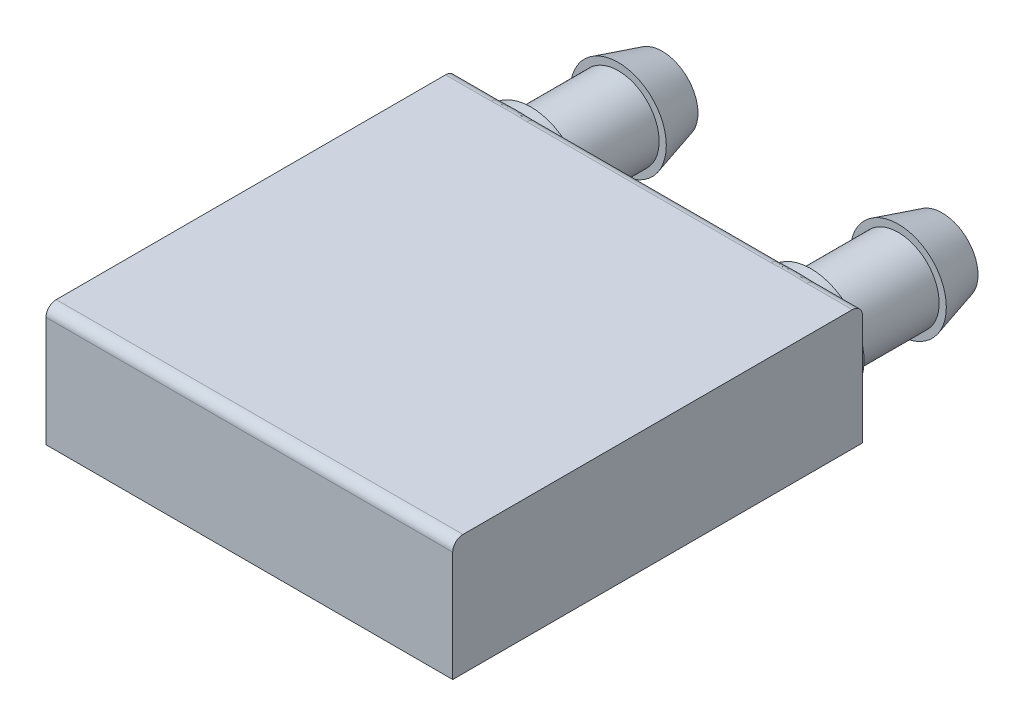
from build123d import *

# Parameters (mm, degrees)
SKETCH1_W           = 39.8
SKETCH1_H           = 40.1
BOSS_EXTRUDE1_DEPTH = 11.8
SKETCH2_R           = 5.2
BOSS_EXTRUDE2_DEPTH = 1.15
SKETCH3_R           = 4
BOSS_EXTRUDE3_DEPTH = 8.55
SKETCH4_W           = 1.985131543
SKETCH4_H           = 1.538416695
BOSS_EXTRUDE4_DEPTH = 1
SKETCH10_W          = 1.450314217
SKETCH10_H          = 0.967398797
BOSS_EXTRUDE5_DEPTH = 1
SKETCH12_R          = 3.15
CUT_EXTRUDE1_DEPTH  = 15
FILLET1_R           = 1


with BuildPart() as part:
    # Sketch1 → Boss-Extrude1 (new body)
    with BuildSketch(Plane(origin=(0, 0, 0), x_dir=(1, 0, 0), z_dir=(0, 1, 0))):
        with Locations((19.9, 20.05)):
            Rectangle(SKETCH1_W, SKETCH1_H)
    extrude(amount=BOSS_EXTRUDE1_DEPTH)

    # Sketch2 → Boss-Extrude2 (add)
    with BuildSketch(Plane(origin=(0, 0, -40.1), x_dir=(-1, 0, 0), z_dir=(0, 0, -1))):
        with Locations(Location((-6.2, 5.9, 0), (0, 0, 180))):
            Circle(SKETCH2_R)
        with Locations(Location((-33.6, 5.9, 0), (0, 0, 180))):
            Circle(SKETCH2_R)
    extrude(amount=BOSS_EXTRUDE2_DEPTH)

    # Sketch3 → Boss-Extrude3 (add)
    with BuildSketch(Plane(origin=(0, 0, -41.25), x_dir=(-1, 0, 0), z_dir=(0, 0, -1))):
        with Locations((-33.6, 5.9)):
            Circle(SKETCH3_R)
        with Locations((-6.2, 5.9)):
            Circle(SKETCH3_R)
    extrude(amount=BOSS_EXTRUDE3_DEPTH)

    # Sketch4 → Boss-Extrude4 (add)
    with BuildSketch(Plane(origin=(0, 0, -49.8), x_dir=(-1, 0, 0), z_dir=(0, 0, -1))):
        with Locations((-7.192565771, 5.130791653)):
            Rectangle(SKETCH4_W, SKETCH4_H)
    extrude(amount=BOSS_EXTRUDE4_DEPTH)

    # Sketch7 → Revolve2 (revolve)
    with BuildSketch(Plane(origin=(0, 5.9, 0), x_dir=(1, 0, 0), z_dir=(0, 1, 0))):
        Polygon((6.2, 49.8), (10.9, 49.8), (9.7, 54.1), (6.2, 54.1), align=None)
    revolve(axis=Axis((6.2, 5.9, -49.8), (0, 0, -1)))

    # Sketch10 → Boss-Extrude5 (add)
    with BuildSketch(Plane(origin=(0, 0, -49.8), x_dir=(-1, 0, 0), z_dir=(0, 0, -1))):
        with Locations((-34.325157109, 5.416300601)):
            Rectangle(SKETCH10_W, SKETCH10_H)
    extrude(amount=BOSS_EXTRUDE5_DEPTH)

    # Sketch11 → Revolve4 (revolve)
    with BuildSketch(Plane(origin=(0, 5.9, 0), x_dir=(1, 0, 0), z_dir=(0, 1, 0)), mode=Mode.PRIVATE) as revolve4_sk:
        Polygon((33.6, 49.8), (28.9, 49.8), (30.1, 54.1), (33.6, 54.1), align=None)
    revolve(revolve4_sk.sketch.rotate(Axis((33.6, 5.9, -49.8), (0, 0, -1)), 180), axis=Axis((33.6, 5.9, -49.8), (0, 0, -1)))

    # Sketch12 → Cut-Extrude1 (cut)
    with BuildSketch(Plane(origin=(0, 0, -54.1), x_dir=(-1, 0, 0), z_dir=(0, 0, -1))):
        with Locations((-6.2, 5.9)):
            Circle(SKETCH12_R)
        with Locations((-33.6, 5.9)):
            Circle(SKETCH12_R)
    extrude(amount=-CUT_EXTRUDE1_DEPTH, mode=Mode.SUBTRACT)

    # Fillet1
    fillet1_edges = [part.edges().sort_by_distance(p)[0] for p in [
        (19.9, 11.8, -40.1),
        (19.9, 11.8, 0),
    ]]
    fillet(fillet1_edges, radius=FILLET1_R)


solid = part.part
